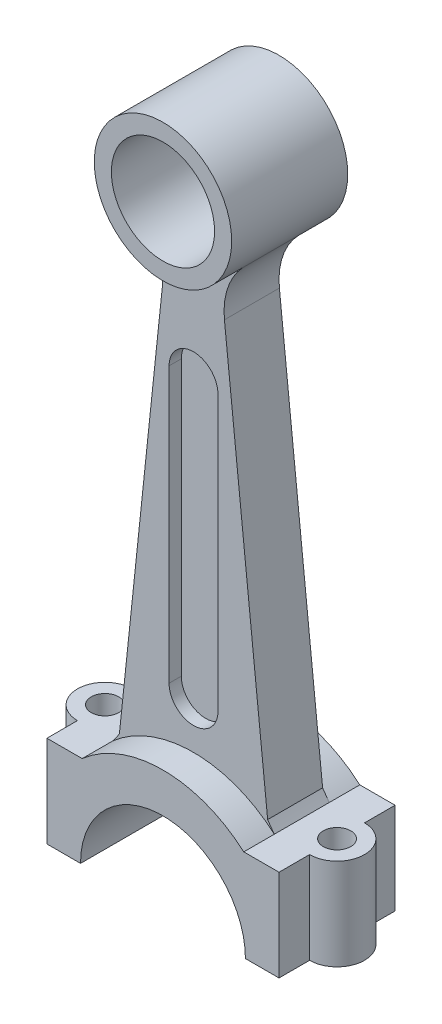
from build123d import *

# Parameters (mm, degrees)
SKETCH1_R           = 16.9
BOSS_EXTRUDE1_DEPTH = 19
SKETCH2_R           = 4.5
CUT_EXTRUDE2_DEPTH  = 38
CUT_EXTRUDE3_DEPTH  = 10
CUT_EXTRUDE4_DEPTH  = 4


with BuildPart() as part:
    # Sketch1 → Boss-Extrude1 (new, symmetric)
    with BuildSketch(Plane.XY):
        with BuildLine():
            Line((47, -69.313412318), (47, -39.313412318))
            Line((47, -39.313412318), (26.457513111, -39.313412318))
            ThreePointArc((26.457513111, -39.313412318), (25.35270378, -37.792402472), (24.27668208, -36.250892852))
            Line((24.27668208, -36.250892852), (10.123257354, 98.409948263))
            ThreePointArc((10.123257354, 98.409948263), (11.210647408, 108.042873382), (16.25, 116.324213184))
            ThreePointArc((16.25, 116.324213184), (0, 154.386587682), (-16.25, 116.324213184))
            ThreePointArc((-16.25, 116.324213184), (-11.210647408, 108.042873382), (-10.123257354, 98.409948263))
            Line((-10.123257354, 98.409948263), (-24.27668208, -36.250892852))
            ThreePointArc((-24.27668208, -36.250892852), (-25.35270378, -37.792402472), (-26.457513111, -39.313412318))
            Line((-26.457513111, -39.313412318), (-47, -39.313412318))
            Line((-47, -39.313412318), (-47, -69.313412318))
            Line((-47, -69.313412318), (-40, -69.313412318))
            Line((-40, -69.313412318), (-27, -69.313412318))
            ThreePointArc((-27, -69.313412318), (0, -42.313412318), (27, -69.313412318))
            Line((27, -69.313412318), (40, -69.313412318))
            Line((40, -69.313412318), (47, -69.313412318))
        make_face()
        with Locations((0, 131.886587682)):
            Circle(SKETCH1_R, mode=Mode.SUBTRACT)
    extrude(amount=BOSS_EXTRUDE1_DEPTH, both=True)

    # Sketch2 → Cut-Extrude2 (cut)
    with BuildSketch(Plane.XZ.offset(69.313412318)):
        with BuildLine():
            Line((-38, 19), (-47, 19))
            Line((-47, 19), (-47, 6.6e-08))
            ThreePointArc((-47, 6.6e-08), (-44.363961007, 6.363961054), (-38, 9))
            Line((-38, 9), (-38, 19))
        make_face()
        with BuildLine():
            ThreePointArc((-38, -9), (-44.363961054, -6.363961007), (-47, 6.6e-08))
            Line((-47, 6.6e-08), (-47, -19))
            Line((-47, -19), (-38, -19))
            Line((-38, -19), (-38, -9))
        make_face()
        with BuildLine():
            Line((47, 19), (38, 19))
            Line((38, 19), (38, 9))
            ThreePointArc((38, 9), (44.363961031, 6.363961031), (47, 0))
            Line((47, 0), (47, 19))
        make_face()
        with BuildLine():
            Line((38, -9), (38, -19))
            Line((38, -19), (47, -19))
            Line((47, -19), (47, 0))
            ThreePointArc((47, 0), (44.363961031, -6.363961031), (38, -9))
        make_face()
        with Locations(Location((38, 0, 0), (0, 0, 270))):
            Circle(SKETCH2_R)
        with Locations(Location((-38, 0, 0), (0, 0, 270))):
            Circle(SKETCH2_R)
    extrude(amount=-CUT_EXTRUDE2_DEPTH, mode=Mode.SUBTRACT)

    # Sketch3 → Cut-Extrude3 (cut)
    with BuildSketch(Plane.XY.offset(19)):
        with BuildLine():
            Line((-26.457513111, -39.313412318), (-22.5, 131.886587682))
            ThreePointArc((-22.5, 131.886587682), (0, 109.386587682), (22.5, 131.886587682))
            Line((22.5, 131.886587682), (26.457513111, -39.313412318))
            ThreePointArc((26.457513111, -39.313412318), (0, -29.313412318), (-26.457513111, -39.313412318))
        make_face()
    cut_extrude3 = extrude(amount=-CUT_EXTRUDE3_DEPTH, mode=Mode.SUBTRACT)

    # Mirror1: Cut-Extrude3 across plane
    add(cut_extrude3.mirror(Plane.XY), mode=Mode.SUBTRACT)

    # Sketch4 → Cut-Extrude4 (cut)
    with BuildSketch(Plane.XY.offset(9)):
        with BuildLine():
            Line((8, 76.286587682), (8, -13.713412318))
            ThreePointArc((8, -13.713412318), (0, -21.713412318), (-8, -13.713412318))
            Line((-8, -13.713412318), (-8, 76.286587682))
            ThreePointArc((-8, 76.286587682), (0, 84.286587682), (8, 76.286587682))
        make_face()
    cut_extrude4 = extrude(amount=-CUT_EXTRUDE4_DEPTH, mode=Mode.SUBTRACT)

    # Mirror2: Cut-Extrude4 across plane
    add(cut_extrude4.mirror(Plane.XY), mode=Mode.SUBTRACT)


solid = part.part
